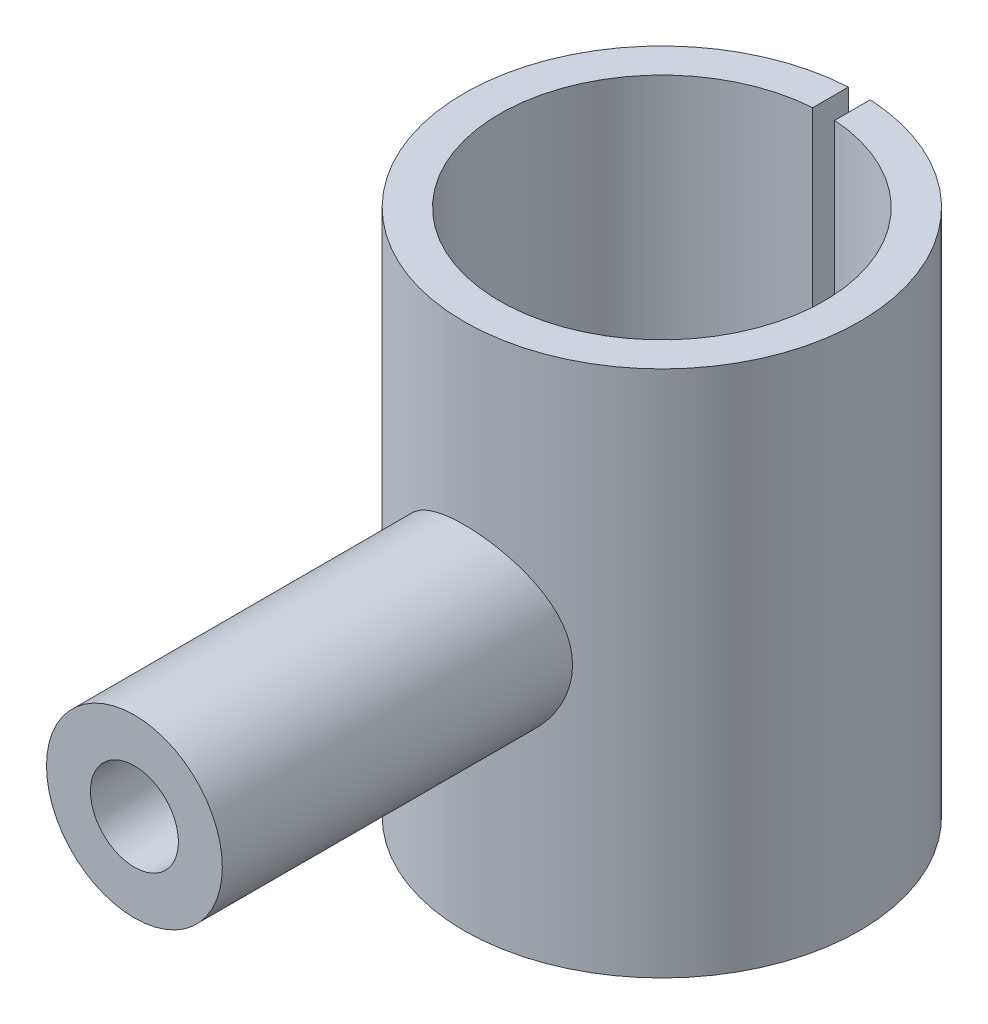
from build123d import *

# Parameters (mm, degrees)
SKETCH1_R           = 28.575
SKETCH1_R_2         = 23.4315
BOSS_EXTRUDE1_DEPTH = 76.2
BOSS_EXTRUDE2_DEPTH = 76.2
BOSS_EXTRUDE4_START = -31.75
SKETCH5_R           = 12.7
BOSS_EXTRUDE4_DEPTH = 31.75
SKETCH3_R           = 23.4315
CUT_EXTRUDE1_DEPTH  = 112.487266812
SKETCH6_W           = 3.175
SKETCH6_H           = 34.556340068
CUT_EXTRUDE2_DEPTH  = 112.487266812


with BuildPart() as part:
    # Sketch1 → Boss-Extrude1 (new body)
    with BuildSketch(Plane(origin=(0, 0, 0), x_dir=(1, 0, 0), z_dir=(0, 1, 0))):
        with Locations(Location((0, 0, 0), (0, 0, 90))):
            Circle(SKETCH1_R)
        with Locations(Location((0, 0, 0), (0, 0, 90))):
            Circle(SKETCH1_R_2, mode=Mode.SUBTRACT)
    extrude(amount=BOSS_EXTRUDE1_DEPTH)

    # Sketch2 → Boss-Extrude2 (add)
    with BuildSketch(Plane.XY):
        with BuildLine():
            ThreePointArc((-6.35, 38.1), (0, 44.45), (6.35, 38.1))
            Line((6.35, 38.1), (12.7, 38.1))
            ThreePointArc((12.7, 38.1), (0, 50.8), (-12.7, 38.1))
            Line((-12.7, 38.1), (-6.35, 38.1))
        make_face()
        with BuildLine():
            Line((12.7, 38.1), (6.35, 38.1))
            ThreePointArc((6.35, 38.1), (0, 31.75), (-6.35, 38.1))
            Line((-6.35, 38.1), (-12.7, 38.1))
            ThreePointArc((-12.7, 38.1), (0, 25.4), (12.7, 38.1))
        make_face()
    extrude(amount=BOSS_EXTRUDE2_DEPTH)

    # Sketch5 → Boss-Extrude4 (add)
    with BuildSketch(Plane.XY.offset(31.75).offset(BOSS_EXTRUDE4_START)):
        with Locations(Location((0, 38.1, 0), (0, 0, 180))):
            Circle(SKETCH5_R)
    extrude(amount=BOSS_EXTRUDE4_DEPTH)

    # Sketch3 → Cut-Extrude1 (cut, through all)
    with BuildSketch(Plane(origin=(0, 76.2, 0), x_dir=(1, 0, 0), z_dir=(0, 1, 0))):
        with Locations(Location((0, 0, 0), (0, 0, 90))):
            Circle(SKETCH3_R)
    extrude(amount=-CUT_EXTRUDE1_DEPTH, mode=Mode.SUBTRACT)

    # Sketch6 → Cut-Extrude2 (cut, through all)
    with BuildSketch(Plane(origin=(0, 76.2, 0), x_dir=(1, 0, 0), z_dir=(0, 1, 0))):
        with Locations((0, 23.4315)):
            Rectangle(SKETCH6_W, SKETCH6_H)
    extrude(amount=-CUT_EXTRUDE2_DEPTH, mode=Mode.SUBTRACT)


solid = part.part
